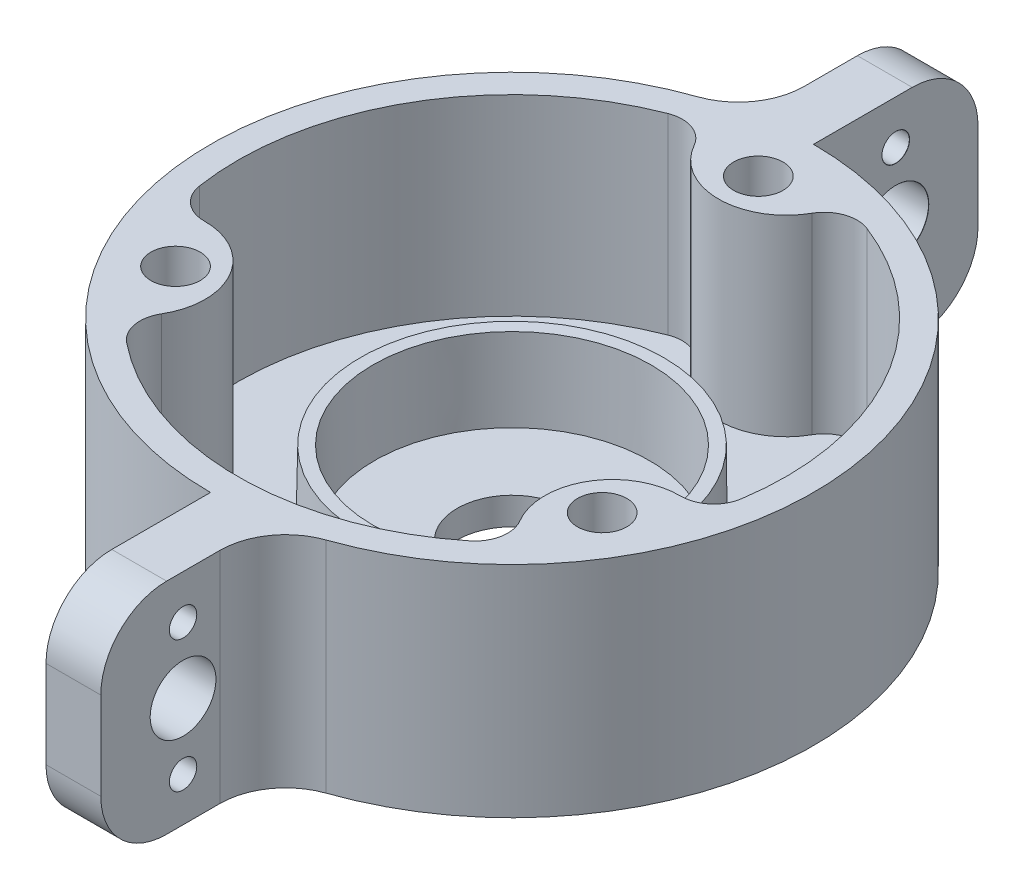
from build123d import *

# Parameters (mm, degrees)
SKETCH1_R                        = 55
SKETCH1_R_2                      = 50
BOSS_EXTRUDE1_DEPTH              = 40
SKETCH1_2_R                      = 50
SKETCH1_2_R_2                    = 10
BOSS_EXTRUDE2_DEPTH              = 5
SKETCH1_4_R                      = 28
SKETCH1_4_R_2                    = 25
BOSS_EXTRUDE8_DEPTH              = 20
BOSS_EXTRUDE8_DRAFT              = 1
SKETCH2_R                        = 4.5
BOSS_EXTRUDE3_DEPTH              = 35
FILLET1_R                        = 6
CIRPATTERN1_COUNT                = 3
FILLET1_OF_CIRPATTERN1_R         = 6
BOSS_EXTRUDE7_DEPTH              = 40
FILLET2_R                        = 12
F_5_0MM_DOWEL_HOLE1_D            = 5
F_5_0MM_DOWEL_HOLE1_CSINK_D      = 5.05
F_5_0MM_DOWEL_HOLE1_CSINK_ANGLE  = 90
F_12_0MM_DOWEL_HOLE1_D           = 12
F_12_0MM_DOWEL_HOLE1_CSINK_D     = 12.05
F_12_0MM_DOWEL_HOLE1_CSINK_ANGLE = 90
FILLET3_R                        = 12
CIRPATTERN2_COUNT                = 2
FILLET2_OF_CIRPATTERN2_R         = 12
FILLET3_OF_CIRPATTERN2_R         = 12


with BuildPart() as part:
    # Sketch1 → Boss-Extrude1 (new body)
    with BuildSketch(Plane(origin=(0, 0, 0), x_dir=(1, 0, 0), z_dir=(0, 1, 0))):
        with Locations(Location((0, 0, 0), (0, 0, 270))):
            Circle(SKETCH1_R)
        with Locations(Location((0, 0, 0), (0, 0, 270))):
            Circle(SKETCH1_R_2, mode=Mode.SUBTRACT)
    extrude(amount=BOSS_EXTRUDE1_DEPTH)

    # Sketch1<2> → Boss-Extrude2 (add)
    with BuildSketch(Plane(origin=(0, 0, 0), x_dir=(1, 0, 0), z_dir=(0, 1, 0))):
        with Locations(Location((0, 0, 0), (0, 0, 270))):
            Circle(SKETCH1_2_R)
        with Locations(Location((0, 0, 0), (0, 0, 270))):
            Circle(SKETCH1_2_R_2, mode=Mode.SUBTRACT)
    extrude(amount=BOSS_EXTRUDE2_DEPTH)


with BuildPart() as boss_extrude8_tool:
    # Sketch1<4> → Boss-Extrude8 (with draft: the straight prism first)
    with BuildSketch(Plane(origin=(0, 0, 0), x_dir=(1, 0, 0), z_dir=(0, 1, 0))):
        Circle(SKETCH1_4_R)
        Circle(SKETCH1_4_R_2, mode=Mode.SUBTRACT)
    extrude(amount=BOSS_EXTRUDE8_DEPTH)
    # Boss-Extrude8: the draft: its side faces are tilted about the plane it starts from
    boss_extrude8_sides = [boss_extrude8_tool.faces().sort_by_distance(p)[0] for p in [
        (-28, 10, 0),
        (-25, 10, 0),
    ]]
    draft(boss_extrude8_sides, Plane(origin=(0, 0, 0), x_dir=(1, 0, 0), z_dir=(0, 1, 0)), BOSS_EXTRUDE8_DRAFT)


with BuildPart() as part_1:
    add(part.part)

    # Boss-Extrude8: add boss_extrude8_tool
    add(boss_extrude8_tool.part)

    # Sketch2 → Boss-Extrude3 (add)
    with BuildSketch(Plane(origin=(0, 5, 0), x_dir=(1, 0, 0), z_dir=(0, 1, 0))):
        with BuildLine():
            ThreePointArc((-12.220451707, 48.483611252), (0, 37.685826265), (12.220451707, 48.483611252))
            ThreePointArc((12.220451707, 48.483611252), (0, 50), (-12.220451707, 48.483611252))
        make_face()
        with Locations(Location((0, 44.925923132, 0), (0, 0, 270))):
            Circle(SKETCH2_R, mode=Mode.SUBTRACT)
    boss_extrude3 = extrude(amount=BOSS_EXTRUDE3_DEPTH)

    # Fillet1
    fillet1_edges = [part_1.edges().sort_by_distance(p)[0] for p in [
        (12.220451707, 22.5, -48.483611252),
        (-12.220451707, 22.5, -48.483611252),
    ]]
    fillet(fillet1_edges, radius=FILLET1_R)

    # CirPattern1: Boss-Extrude3 ×3 about axis
    cirpattern1_axis = Axis((0, 0, 0), (0, 1, 0))
    for i in range(1, CIRPATTERN1_COUNT):
        add(boss_extrude3.rotate(cirpattern1_axis, i * 360 / CIRPATTERN1_COUNT))

    # Fillet1 of CirPattern1
    fillet1_of_cirpattern1_edges = [part_1.edges().sort_by_distance(p)[0] for p in [
        (-48.098264865, 22.5, 13.658584002),
        (-35.877813158, 22.5, 34.825027251),
        (35.877813158, 22.5, 34.825027251),
        (48.098264865, 22.5, 13.658584002),
    ]]
    fillet(fillet1_of_cirpattern1_edges, radius=FILLET1_OF_CIRPATTERN1_R)

    # Sketch3 → Boss-Extrude7 (add)
    with BuildSketch(Plane.XZ):
        with BuildLine():
            Line((0, -55), (0, -85))
            Line((0, -85), (-10, -85))
            Line((-10, -85), (-10, -54.083269132))
            ThreePointArc((-10, -54.083269132), (-5.02096593, -54.770337785), (0, -55))
        make_face()
    boss_extrude7 = extrude(amount=-BOSS_EXTRUDE7_DEPTH)

    # Fillet2
    fillet2_edges = [part_1.edges().sort_by_distance(p)[0] for p in [
        (-10, 20, -54.083269132),
    ]]
    fillet(fillet2_edges, radius=FILLET2_R)

    # Ø5.0mm Dowel Hole1 (through all)
    with Locations(Plane(origin=(0, 0, 0), x_dir=(0, 0, -1), z_dir=(1, 0, 0))):
        with Locations((70, 32), (70, 8)):
            f_5_0mm_dowel_hole1 = CounterSinkHole(F_5_0MM_DOWEL_HOLE1_D / 2, F_5_0MM_DOWEL_HOLE1_CSINK_D / 2, counter_sink_angle=F_5_0MM_DOWEL_HOLE1_CSINK_ANGLE)

    # Ø12.0mm Dowel Hole1 (through all)
    with Locations(Plane(origin=(0, 0, 0), x_dir=(0, 0, -1), z_dir=(1, 0, 0))):
        with Locations((70, 20)):
            f_12_0mm_dowel_hole1 = CounterSinkHole(F_12_0MM_DOWEL_HOLE1_D / 2, F_12_0MM_DOWEL_HOLE1_CSINK_D / 2, counter_sink_angle=F_12_0MM_DOWEL_HOLE1_CSINK_ANGLE)

    # Fillet3
    fillet3_edges = [part_1.edges().sort_by_distance(p)[0] for p in [
        (-5, 0, -85),
        (-5, 40, -85),
    ]]
    fillet(fillet3_edges, radius=FILLET3_R)

    # CirPattern2: Boss-Extrude7, Ø5.0mm Dowel Hole1, Ø12.0mm Dowel Hole1 ×2 about axis
    cirpattern2_axis = Axis((0, 0, 0), (0, 1, 0))
    add([boss_extrude7.rotate(cirpattern2_axis, i * 360 / CIRPATTERN2_COUNT) for i in range(1, CIRPATTERN2_COUNT)])
    add([f_5_0mm_dowel_hole1.rotate(cirpattern2_axis, i * 360 / CIRPATTERN2_COUNT) for i in range(1, CIRPATTERN2_COUNT)], mode=Mode.SUBTRACT)
    add([f_12_0mm_dowel_hole1.rotate(cirpattern2_axis, i * 360 / CIRPATTERN2_COUNT) for i in range(1, CIRPATTERN2_COUNT)], mode=Mode.SUBTRACT)

    # Fillet2 of CirPattern2
    fillet2_of_cirpattern2_edges = [part_1.edges().sort_by_distance(p)[0] for p in [
        (10, 20, 54.083269132),
    ]]
    fillet(fillet2_of_cirpattern2_edges, radius=FILLET2_OF_CIRPATTERN2_R)

    # Fillet3 of CirPattern2
    fillet3_of_cirpattern2_edges = [part_1.edges().sort_by_distance(p)[0] for p in [
        (5, 0, 85),
        (5, 40, 85),
    ]]
    fillet(fillet3_of_cirpattern2_edges, radius=FILLET3_OF_CIRPATTERN2_R)


solid = part_1.part
